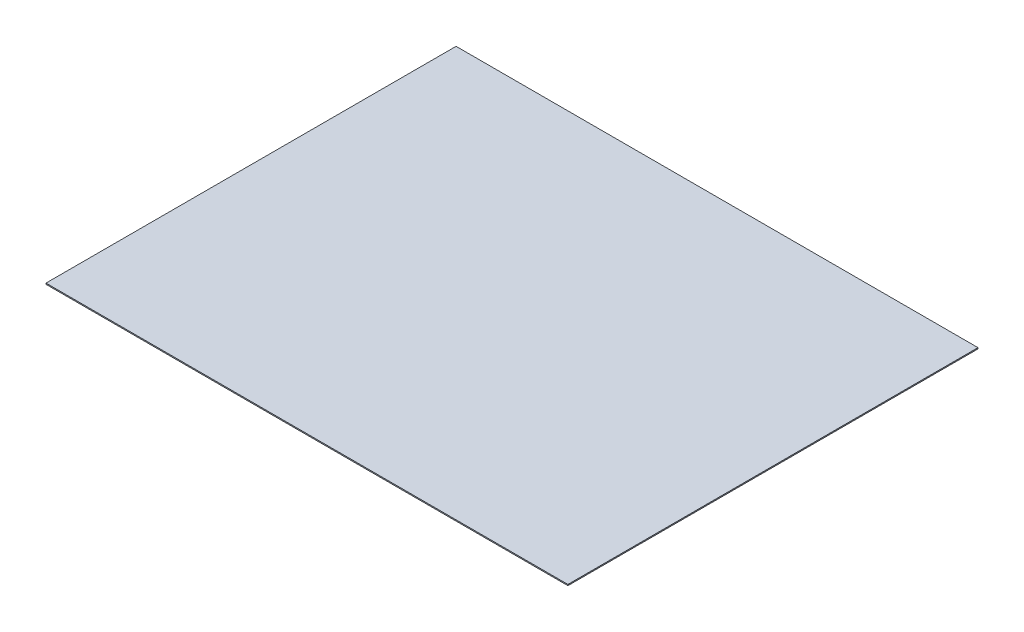
from build123d import *

# Parameters (mm, degrees)
SKETCH1_W           = 700
SKETCH1_H           = 550
BOSS_EXTRUDE1_DEPTH = 1.5


with BuildPart() as part:
    # Sketch1 → Boss-Extrude1 (new body)
    with BuildSketch(Plane(origin=(0, 0, 0), x_dir=(1, 0, 0), z_dir=(0, 1, 0))):
        Rectangle(SKETCH1_W, SKETCH1_H)
    extrude(amount=BOSS_EXTRUDE1_DEPTH)


solid = part.part
